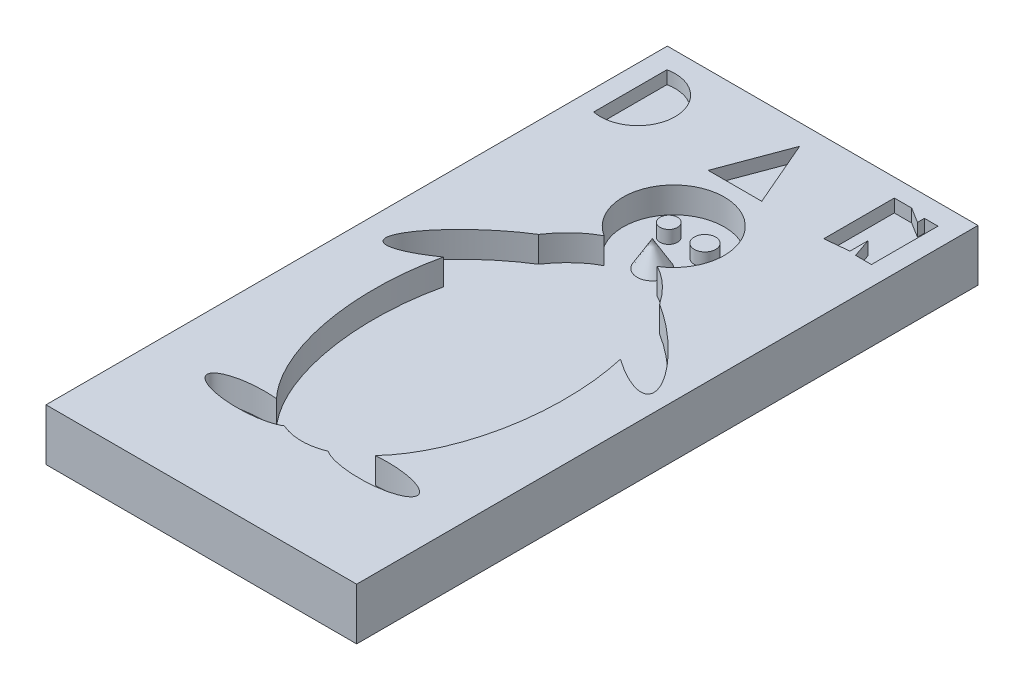
from build123d import *

# Parameters (mm, degrees)
SKETCH1_W           = 76.2
SKETCH1_H           = 152.4
BOSS_EXTRUDE1_DEPTH = 12.7
CUT_EXTRUDE1_DEPTH  = 6.35
SKETCH4_R           = 3.744796995
SKETCH6_R           = 2.147744767
SKETCH6_R_2         = 2.625021382
BOSS_EXTRUDE2_DEPTH = 3.175
CUT_EXTRUDE2_DEPTH  = 3.175


with BuildPart() as part:
    # Sketch1 → Boss-Extrude1 (new body)
    with BuildSketch(Plane(origin=(0, 0, 0), x_dir=(1, 0, 0), z_dir=(0, 1, 0))):
        with Locations((38.1, 76.2)):
            Rectangle(SKETCH1_W, SKETCH1_H)
    extrude(amount=BOSS_EXTRUDE1_DEPTH)

    # Sketch2 → Cut-Extrude1 (cut)
    with BuildSketch(Plane(origin=(0, 12.7, 0), x_dir=(1, 0, 0), z_dir=(0, 1, 0))):
        with BuildLine():
            ThreePointArc((45.554326982, 104.348304437), (39.05455323, 127.328257367), (32.554779478, 104.348304437))
            add(Edge.make_bspline(
                [(32.554779478, 104.348304437), (27.923198079, 101.989560165), (24.199309944, 96.598646365)],
                knots=[0.281636254, 0.281636254, 0.281636254, 0.688273207, 0.688273207, 0.688273207], degree=2, weights=[1, 0.979401903, 1]))
            add(Edge.make_bspline(
                [(24.199309944, 96.598646365), (10.401370614, 88.094838529), (6.623541816, 79.011124554), (2.845713018, 69.927410579), (17.347642511, 80.123948717)],
                knots=[4.137576805, 4.137576805, 4.137576805, 5.801682385, 5.801682385, 7.465787964, 7.465787964, 7.465787964], degree=2, weights=[1, 0.673359521, 1, 0.673359521, 1]))
            add(Edge.make_bspline(
                [(17.347642511, 80.123948717), (9.961238095, 47.695305578), (26.938646337, 29.594967579)],
                knots=[1.189489458, 1.189489458, 1.189489458, 2.596997927, 2.596997927, 2.596997927], degree=2, weights=[1, 0.762418259, 1]))
            add(Edge.make_bspline(
                [(26.938646337, 29.594967579), (4.843164164, 31.605433742), (14.217513543, 24.852116093), (23.591862921, 18.098798445), (33.669344885, 24.74614624)],
                knots=[4.437172344, 4.437172344, 4.437172344, 6.70377495, 6.70377495, 8.970377555, 8.970377555, 8.970377555], degree=2, weights=[1, 0.42367175, 1, 0.42367175, 1]))
            add(Edge.make_bspline(
                [(33.669344885, 24.74614624), (39.05455323, 22.503130488), (44.439761574, 24.74614624)],
                knots=[2.909238116, 2.909238116, 2.909238116, 3.373947191, 3.373947191, 3.373947191], degree=2, weights=[1, 0.973126915, 1]))
            add(Edge.make_bspline(
                [(44.439761574, 24.74614624), (54.517243538, 18.098798445), (63.891592917, 24.852116093), (73.265942295, 31.605433742), (51.170460123, 29.594967579)],
                knots=[3.595993059, 3.595993059, 3.595993059, 5.862595664, 5.862595664, 8.12919827, 8.12919827, 8.12919827], degree=2, weights=[1, 0.42367175, 1, 0.42367175, 1]))
            add(Edge.make_bspline(
                [(51.170460123, 29.594967579), (68.147868364, 47.695305578), (60.761463949, 80.123948717)],
                knots=[3.68618738, 3.68618738, 3.68618738, 5.09369585, 5.09369585, 5.09369585], degree=2, weights=[1, 0.762418259, 1]))
            add(Edge.make_bspline(
                [(60.761463949, 80.123948717), (75.263393441, 69.927410579), (71.485564643, 79.011124554), (67.707735845, 88.094838529), (53.909796516, 96.598646365)],
                knots=[5.10058265, 5.10058265, 5.10058265, 6.76468823, 6.76468823, 8.428793809, 8.428793809, 8.428793809], degree=2, weights=[1, 0.673359521, 1, 0.673359521, 1]))
            add(Edge.make_bspline(
                [(53.909796516, 96.598646365), (50.185908381, 101.989560165), (45.554326982, 104.348304437)],
                knots=[5.5949121, 5.5949121, 5.5949121, 6.001549053, 6.001549053, 6.001549053], degree=2, weights=[1, 0.979401903, 1]))
        make_face()
    extrude(amount=-CUT_EXTRUDE1_DEPTH, mode=Mode.SUBTRACT)

    # Sketch4 → Loft1 section 0
    with BuildSketch(Plane(origin=(0, 6.35, 0), x_dir=(1, 0, 0), z_dir=(0, 1, 0)), mode=Mode.PRIVATE) as loft1_s0:
        with Locations((39.05455323, 109.669022617)):
            Circle(SKETCH4_R)
    loft([loft1_s0.sketch, Vertex(39.05455323, 12.7, -109.669022617)])

    # Sketch6 → Boss-Extrude2 (add)
    with BuildSketch(Plane(origin=(0, 6.35, 0), x_dir=(1, 0, 0), z_dir=(0, 1, 0))):
        with Locations(Location((34.445133471, 118.313867451, 0), (0, 0, 90))):
            Circle(SKETCH6_R)
        with Locations(Location((43.313181821, 118.313867451, 0), (0, 0, 90))):
            Circle(SKETCH6_R_2)
    extrude(amount=BOSS_EXTRUDE2_DEPTH)

    # Sketch7 → Cut-Extrude2 (cut)
    with BuildSketch(Plane(origin=(0, 12.7, 0), x_dir=(1, 0, 0), z_dir=(0, 1, 0))):
        Polygon((31.415995896, 131.008717746), (37.515244229, 147.337843698), (44.550696836, 131.008717746), (41.032970532, 131.008717746), (33.902166631, 131.008717746), align=None)
        with BuildLine():
            Line((4.975149077, 147.330196681), (4.975149077, 129.360621))
            ThreePointArc((4.975149077, 129.360621), (15.965075031, 138.345408841), (4.975149077, 147.330196681))
        make_face()
        Polygon((65.949770063, 131.229413086), (65.949770063, 135.702678285), (67.541790758, 131.030241117), (71.441389338, 131.008717746), (71.441389338, 147.337843698), (68.116741502, 147.337843698), (68.116741502, 145.642054802), (66.966840014, 146.353252882), (64.368883425, 147.960052906), (60.113372227, 147.960052906), (60.113372227, 130.65394574), align=None)
    extrude(amount=-CUT_EXTRUDE2_DEPTH, mode=Mode.SUBTRACT)


solid = part.part
